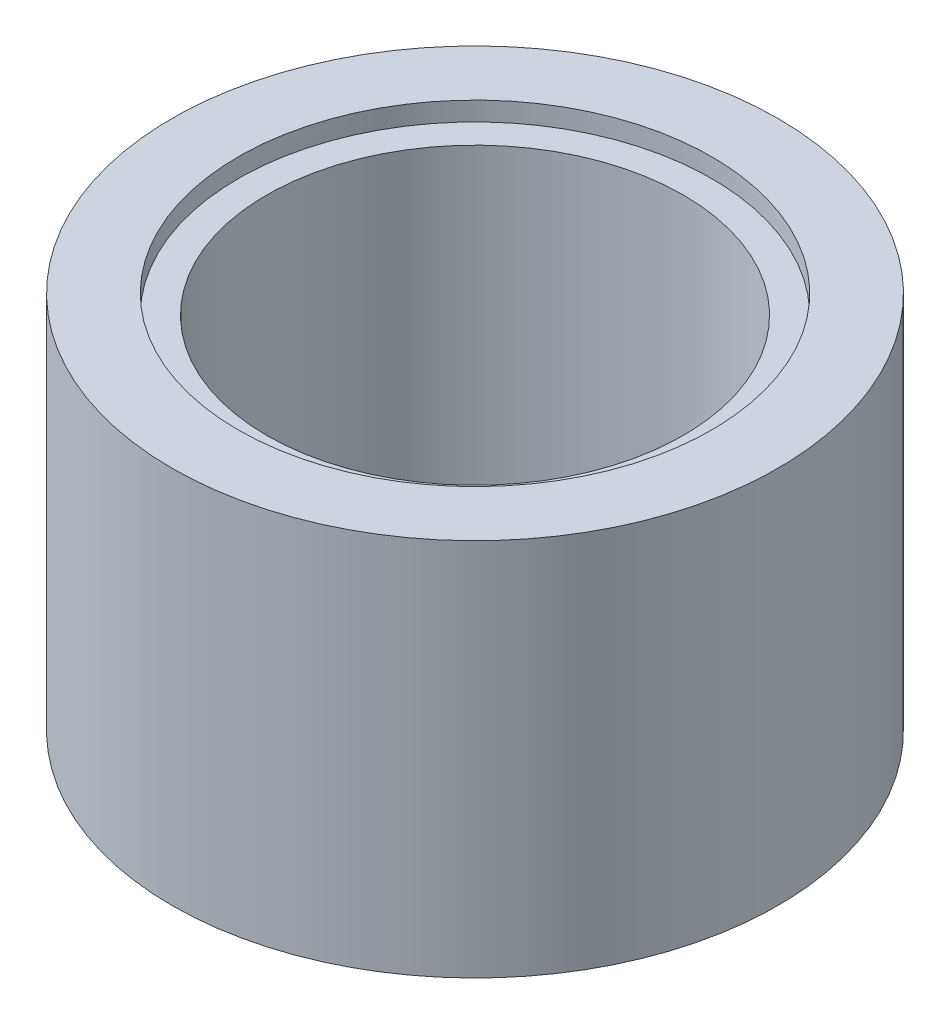
from build123d import *

# Parameters (mm, degrees)
RESSALTO_EXTRUS_O1_DEPTH = 20.2
CORTE_EXTRUS_O1_START    = 20.2
ESBO_O3_R                = 12.5
CORTE_EXTRUS_O1_DEPTH    = 20.2
ESBO_O4_R                = 12.5
CORTE_EXTRUS_O2_DEPTH    = 20.2


with BuildPart() as part:
    # Esboço1 → Revolução1 (revolve)
    with BuildSketch(Plane.XY, mode=Mode.PRIVATE) as revolu_o1_sk:
        Polygon((12.5, 10.813953488), (12.5, 9.813953488), (11, 9.813953488), (11, -8.186046512), (12.5, -8.186046512), (12.5, -9.186046512), (16, -9.186046512), (16, 10.813953488), align=None)
    revolve(revolu_o1_sk.sketch.rotate(Axis((0, 52.869426426, 0), (0, -1, 0)), 90), axis=Axis((0, 52.869426426, 0), (0, -1, 0)))

    # Esboço2 → Ressalto-extrusão1 (add)
    # profile 1 of 8: a face of its own
    with BuildSketch(Plane(origin=(0, 10.813953488, 0), x_dir=(1, 0, 0), z_dir=(0, 1, 0))):
        with BuildLine():
            Line((1.516024046, -15.369686132), (2.077417154, -15.320887515))
            add(Edge.make_bspline(
                [(2.077417154, -15.320887515), (2.113263017, -15.317733839), (2.181909726, -15.311694386), (2.280110643, -15.300785736), (2.368958221, -15.290206131), (2.448127137, -15.278753129), (2.517798588, -15.266435607), (2.57805209, -15.253936485), (2.629210785, -15.241979583), (2.65933787, -15.231646169), (2.672931541, -15.226983619)],
                knots=[0, 0, 0, 0, 1.429554395, 2.737671673, 3.925187674, 4.984139213, 5.915277066, 6.73534434, 7.429373519, 8, 8, 8, 8], degree=3))
            add(Edge.make_bspline(
                [(2.672931541, -15.226983619), (2.692642711, -15.219281418), (2.73125375, -15.204194034), (2.784498092, -15.174763598), (2.833025706, -15.142609039), (2.875804894, -15.106194855), (2.912938981, -15.065642778), (2.945100974, -15.021438877), (2.971399952, -14.97286896), (2.992732084, -14.921107089), (3.007997049, -14.866299625), (3.017531597, -14.809369359), (3.021093795, -14.750433752), (3.018837236, -14.689510248), (3.010437457, -14.626875994), (2.997335518, -14.562043675), (2.977488989, -14.495563764), (2.960240723, -14.451373239), (2.951424105, -14.428784824)],
                knots=[0, 0, 0, 0, 1.054736728, 2.066061024, 3.02803467, 3.955327317, 4.860821345, 5.765487707, 6.675438123, 7.609812719, 8.552964975, 9.507590628, 10.484452325, 11.493601515, 12.544163306, 13.633924628, 14.79055771, 16, 16, 16, 16], degree=3))
            add(Edge.make_bspline(
                [(2.951424105, -14.428784824), (2.934851905, -14.390963262), (2.901900295, -14.315760128), (2.837638355, -14.210506898), (2.763531062, -14.112329753), (2.678974298, -14.022016542), (2.584824013, -13.940825382), (2.4810925, -13.871224583), (2.369222482, -13.812683943), (2.249254069, -13.767159466), (2.123146538, -13.733607458), (1.992334777, -13.711805278), (1.85725557, -13.703677947), (1.766323258, -13.708722233), (1.720244822, -13.711278341)],
                knots=[0, 0, 0, 0, 0.970593667, 1.929896092, 2.893173001, 3.860534365, 4.835136243, 5.811741742, 6.793078132, 7.79939175, 8.824122808, 9.858616152, 10.914889349, 12, 12, 12, 12], degree=3))
            Line((1.720244822, -13.711278341), (2.128189883, -12.314004689))
            Line((2.128189883, -12.314004689), (1.705691892, -12.35101367))
            Line((1.705691892, -12.35101367), (1.300008988, -13.747276245))
            Line((1.300008988, -13.747276245), (1.247793142, -13.752254449))
            Line((1.247793142, -13.752254449), (0.711636256, -12.438011675))
            Line((0.711636256, -12.438011675), (0.333556563, -12.470813528))
            Line((0.333556563, -12.470813528), (1.516024046, -15.369686132))
        make_face()
        with BuildLine():
            Line((1.751625878, -14.987389323), (1.389050261, -14.098303753))
            Line((1.389050261, -14.098303753), (1.761662147, -14.06219833))
            add(Edge.make_bspline(
                [(1.761662147, -14.06219833), (1.801496538, -14.059232991), (1.876293228, -14.053665), (1.981707932, -14.054507306), (2.072774403, -14.062092237), (2.151171884, -14.077781969), (2.220194889, -14.102331565), (2.283359663, -14.135149645), (2.344208392, -14.17430988), (2.399354948, -14.222609067), (2.450638483, -14.27549421), (2.494847106, -14.333788374), (2.533585249, -14.395857781), (2.55326284, -14.440352707), (2.563179874, -14.462777084)],
                knots=[0, 0, 0, 0, 1.477116174, 2.773568202, 3.895349981, 4.853093487, 5.722603131, 6.595547905, 7.481480482, 8.392351399, 9.300777425, 10.202285939, 11.093995156, 12, 12, 12, 12], degree=3))
            add(Edge.make_bspline(
                [(2.563179874, -14.462777084), (2.571316369, -14.484038706), (2.587057264, -14.525171526), (2.598972873, -14.588282809), (2.602849716, -14.64896523), (2.59663423, -14.706561278), (2.581968418, -14.759698548), (2.557987715, -14.806334295), (2.525694026, -14.845798033), (2.491883417, -14.872576531), (2.459437417, -14.890567409), (2.428833095, -14.902231831), (2.393093265, -14.913360621), (2.352095506, -14.923494925), (2.305926433, -14.933007295), (2.254142401, -14.94059607), (2.197001532, -14.947760022), (2.157020729, -14.95149213), (2.136214792, -14.953434312)],
                knots=[0, 0, 0, 0, 1.335783433, 2.584211956, 3.758522392, 4.898865759, 5.973217675, 6.98124721, 7.958332554, 8.948878075, 9.496282004, 10.133685347, 10.869820919, 11.696208238, 12.615001599, 13.639743525, 14.771726804, 16, 16, 16, 16], degree=3))
            Line((2.136214792, -14.953434312), (1.751625878, -14.987389323))
        make_face(mode=Mode.SUBTRACT)
    # profile 2 of 8: a face of its own
    with BuildSketch(Plane(origin=(0, 10.813953488, 0), x_dir=(1, 0, 0), z_dir=(0, 1, 0))):
        with BuildLine():
            add(Edge.make_bspline(
                [(5.168055998, -14.61974926), (5.193489772, -14.612183154), (5.243670141, -14.597255366), (5.3161343, -14.570759177), (5.385143323, -14.541970542), (5.450311213, -14.510734068), (5.511242439, -14.475663659), (5.569130417, -14.439485225), (5.622371479, -14.399078377), (5.672863455, -14.357611654), (5.718659051, -14.312111302), (5.761111154, -14.264430449), (5.799818868, -14.214078392), (5.834352104, -14.160849255), (5.865446763, -14.105253451), (5.893165617, -14.047015306), (5.915419363, -13.985534935), (5.942223358, -13.901301978), (5.96466416, -13.792255901), (5.976456524, -13.658832599), (5.970416326, -13.523673238), (5.950036327, -13.386949218), (5.912112975, -13.248932139), (5.859438823, -13.109193689), (5.790181148, -12.967820734), (5.733585137, -12.876409921), (5.704460999, -12.829370191)],
                knots=[0, 0, 0, 0, 0.852826853, 1.682611723, 2.478706154, 3.255956535, 4.003621665, 4.737742638, 5.448444647, 6.150576596, 6.836456885, 7.521096691, 8.201666468, 8.875839165, 9.558841728, 10.248309801, 10.946384605, 11.658805717, 13.088818744, 14.51450468, 15.953781222, 17.42756226, 18.949185421, 20.54545786, 22.222302952, 24, 24, 24, 24], degree=3))
            add(Edge.make_bspline(
                [(5.704460999, -12.829370191), (5.672986869, -12.783056907), (5.61015858, -12.690606873), (5.503121031, -12.561572766), (5.387076201, -12.440918591), (5.262099841, -12.328492408), (5.127565858, -12.225040156), (4.983451233, -12.130298532), (4.829965612, -12.044179341), (4.669285156, -11.966815014), (4.504763856, -11.901158509), (4.340280256, -11.848938534), (4.177452689, -11.811629179), (4.016551656, -11.789558699), (3.857415483, -11.781013016), (3.700449848, -11.787891457), (3.545071552, -11.808487633), (3.444178877, -11.834394432), (3.393520843, -11.84740219)],
                knots=[0, 0, 0, 0, 1.004883579, 2.005936806, 3.005444722, 4.008311774, 5.021106379, 6.04949647, 7.102054222, 8.178669655, 9.249061565, 10.279706934, 11.274076825, 12.24432949, 13.192186435, 14.131220685, 15.06168921, 16, 16, 16, 16], degree=3))
            add(Edge.make_bspline(
                [(3.393520843, -11.84740219), (3.369658174, -11.854458471), (3.322619579, -11.86836796), (3.254672211, -11.893384433), (3.190013469, -11.920856578), (3.129000794, -11.95122695), (3.0713671, -11.984359474), (3.017339611, -12.020255756), (2.966694605, -12.058964998), (2.91988673, -12.100567951), (2.875700557, -12.143975099), (2.836459992, -12.191245558), (2.799263175, -12.240309766), (2.766740566, -12.292978508), (2.736545027, -12.347738635), (2.711505695, -12.405856019), (2.688647753, -12.466197361), (2.663082183, -12.549950749), (2.640754903, -12.657988765), (2.630095007, -12.790240818), (2.635679547, -12.924078051), (2.655992065, -13.059690441), (2.694123123, -13.196470641), (2.746618826, -13.335103834), (2.815946457, -13.475035844), (2.872005932, -13.565804167), (2.900865113, -13.612531314)],
                knots=[0, 0, 0, 0, 0.819233324, 1.614889931, 2.38271577, 3.131635996, 3.857723118, 4.570412591, 5.266172037, 5.95479659, 6.631662535, 7.303398312, 7.975910962, 8.657421696, 9.33979383, 10.033204054, 10.739053121, 11.463850646, 12.914840829, 14.362107669, 15.821753685, 17.316744485, 18.867242849, 20.488207846, 22.192144293, 24, 24, 24, 24], degree=3))
            add(Edge.make_bspline(
                [(2.900865113, -13.612531314), (2.921790672, -13.64365046), (2.963597543, -13.705822949), (3.031889051, -13.795389903), (3.104954334, -13.881411506), (3.18254883, -13.964355333), (3.264292068, -14.044409207), (3.351183222, -14.12050004), (3.442389109, -14.193475693), (3.537333838, -14.263029653), (3.635363654, -14.328438403), (3.735766517, -14.387904554), (3.837149489, -14.442292481), (3.939676737, -14.491508932), (4.043889509, -14.534619505), (4.149570291, -14.571951708), (4.256426516, -14.604002321), (4.363968124, -14.630630129), (4.471225019, -14.650942508), (4.576954074, -14.665295206), (4.680485144, -14.673535529), (4.782283887, -14.67559474), (4.881864668, -14.671074989), (4.979454382, -14.660838902), (5.074849637, -14.644013624), (5.137026925, -14.627827043), (5.168055998, -14.61974926)],
                knots=[0, 0, 0, 0, 1.023438641, 2.044713191, 3.072408161, 4.102950259, 5.144013593, 6.194098677, 7.254158618, 8.331466217, 9.405772335, 10.469562786, 11.515368312, 12.545344517, 13.572530241, 14.592149385, 15.603421293, 16.61653933, 17.61482269, 18.581657687, 19.527625814, 20.448205477, 21.359055375, 22.24676542, 23.125062452, 24, 24, 24, 24], degree=3))
        make_face()
        with BuildLine():
            add(Edge.make_bspline(
                [(4.974863724, -14.299690104), (4.953841617, -14.305245789), (4.911365845, -14.31647121), (4.845534698, -14.326342959), (4.777429985, -14.333590634), (4.706982138, -14.335096668), (4.634006453, -14.332949666), (4.558993606, -14.325993046), (4.481574676, -14.314509001), (4.374910616, -14.294329427), (4.241000466, -14.256869919), (4.083195593, -14.195612965), (3.92867985, -14.117212904), (3.804443307, -14.038707488), (3.707608832, -13.968596676), (3.63768382, -13.911922998), (3.57028394, -13.852207629), (3.506019279, -13.789306582), (3.445453617, -13.722479917), (3.386927745, -13.653491382), (3.332127668, -13.580540205), (3.298213159, -13.529789404), (3.281169134, -13.504284157)],
                knots=[0, 0, 0, 0, 0.65631654, 1.326106448, 2.008031022, 2.724081162, 3.452425234, 4.212429153, 4.9980401, 5.815802657, 7.490318425, 9.189404881, 10.921358311, 12.71562056, 13.622382436, 14.531322093, 15.433144437, 16.341600594, 17.245956807, 18.15644596, 19.073506234, 20, 20, 20, 20], degree=3))
            add(Edge.make_bspline(
                [(3.281169134, -13.504284157), (3.25792889, -13.467039576), (3.21283444, -13.394771662), (3.157798716, -13.283404666), (3.114009293, -13.174706003), (3.083127175, -13.067937249), (3.065331767, -12.963021974), (3.059916209, -12.860391453), (3.066984305, -12.759767267), (3.087051398, -12.662874955), (3.116967419, -12.571056698), (3.156919961, -12.486776303), (3.205650751, -12.410705075), (3.264673734, -12.344078006), (3.331916631, -12.285081938), (3.409318037, -12.236206694), (3.494831402, -12.194071342), (3.556754161, -12.174777901), (3.588622736, -12.164848523)],
                knots=[0, 0, 0, 0, 1.291537752, 2.506048847, 3.65102329, 4.737154995, 5.770851479, 6.776537519, 7.755419125, 8.731383893, 9.681883457, 10.591333095, 11.469765507, 12.331615824, 13.203114208, 14.093556132, 15.018847862, 16, 16, 16, 16], degree=3))
            add(Edge.make_bspline(
                [(3.588622736, -12.164848523), (3.612451172, -12.15852668), (3.660271245, -12.145839696), (3.733765312, -12.132944567), (3.808772758, -12.124110247), (3.885378731, -12.121324216), (3.963585342, -12.121807845), (4.04314197, -12.128453616), (4.124460953, -12.138492855), (4.234468065, -12.159582206), (4.371500201, -12.195939664), (4.531911196, -12.257103294), (4.687340748, -12.335686284), (4.837055657, -12.429698606), (4.978542929, -12.537452014), (5.107286855, -12.65920423), (5.225649046, -12.791021742), (5.292452064, -12.888308065), (5.326004085, -12.93717042)],
                knots=[0, 0, 0, 0, 0.584350273, 1.172702728, 1.767615094, 2.373892351, 2.989238737, 3.621031507, 4.265745856, 4.931348638, 6.275727177, 7.621942329, 8.994647838, 10.398944934, 11.808878628, 13.20418096, 14.595791281, 16, 16, 16, 16], degree=3))
            add(Edge.make_bspline(
                [(5.326004085, -12.93717042), (5.341572276, -12.961706394), (5.372202493, -13.009980608), (5.411667959, -13.084374407), (5.447374822, -13.157302427), (5.476350613, -13.230046078), (5.500137846, -13.302058453), (5.518719078, -13.373410489), (5.531692181, -13.44435529), (5.53970341, -13.514430935), (5.541745613, -13.58332551), (5.538074385, -13.650180834), (5.529550694, -13.715146476), (5.514962388, -13.777905602), (5.495259614, -13.838878298), (5.47037175, -13.89763965), (5.440273714, -13.954622981), (5.404030071, -14.008655175), (5.363874012, -14.060156676), (5.319162634, -14.107177275), (5.271121145, -14.150118785), (5.219367755, -14.189087265), (5.163346246, -14.223150822), (5.103929743, -14.253177742), (5.040982396, -14.279174146), (4.99714591, -14.292776166), (4.974863724, -14.299690104)],
                knots=[0, 0, 0, 0, 1.25039308, 2.460132442, 3.622857722, 4.744304211, 5.827674117, 6.885835426, 7.915468077, 8.929821273, 9.919236666, 10.878584119, 11.809330153, 12.736153193, 13.648135106, 14.564387669, 15.479950145, 16.417700352, 17.361457786, 18.287999977, 19.206643525, 20.132583609, 21.072551471, 22.025014544, 22.996110411, 24, 24, 24, 24], degree=3))
        make_face(mode=Mode.SUBTRACT)
    # profile 3 of 8: a face of its own
    with BuildSketch(Plane(origin=(0, 10.813953488, 0), x_dir=(1, 0, 0), z_dir=(0, 1, 0))):
        with BuildLine():
            Line((7.017208584, -13.770182218), (7.526197809, -13.519547372))
            add(Edge.make_bspline(
                [(7.526197809, -13.519547372), (7.551279779, -13.50699373), (7.599794091, -13.482712093), (7.667978375, -13.44369034), (7.73035818, -13.405659932), (7.786066176, -13.367035033), (7.835207628, -13.327850905), (7.878373425, -13.289077406), (7.915064487, -13.249986562), (7.944883155, -13.210202493), (7.969789597, -13.170283899), (7.990024676, -13.129741043), (8.005161983, -13.088155438), (8.016849251, -13.046220232), (8.02305995, -13.003321182), (8.02575379, -12.959769982), (8.023846259, -12.915311908), (8.014593644, -12.85507582), (7.992703644, -12.780287097), (7.953819766, -12.692703149), (7.899197077, -12.608594268), (7.85418016, -12.557206968), (7.830980284, -12.530724057)],
                knots=[0, 0, 0, 0, 1.320805525, 2.554742348, 3.698875567, 4.761062446, 5.745070481, 6.657347345, 7.491962475, 8.265636352, 8.995130876, 9.705709587, 10.395243085, 11.076790568, 11.752237162, 12.432608096, 13.129653145, 13.843544012, 15.298439316, 16.784871053, 18.343054185, 20, 20, 20, 20], degree=3))
            add(Edge.make_bspline(
                [(7.830980284, -12.530724057), (7.807247905, -12.50674433), (7.759527808, -12.458526877), (7.677148443, -12.397330415), (7.588792699, -12.341234854), (7.492991838, -12.294816524), (7.39343233, -12.257296763), (7.292035997, -12.231647435), (7.190438715, -12.217721607), (7.122743203, -12.218451221), (7.089172848, -12.218813038)],
                knots=[0, 0, 0, 0, 0.975972848, 1.962446234, 2.964296092, 4.004450508, 5.039900446, 6.041094716, 7.028574507, 8, 8, 8, 8], degree=3))
            add(Edge.make_bspline(
                [(7.089172848, -12.218813038), (7.108519959, -12.197545471), (7.145732057, -12.156639579), (7.189280993, -12.088773373), (7.222947595, -12.020691215), (7.242705733, -11.95036096), (7.251920788, -11.879635693), (7.25081242, -11.808419078), (7.2404608, -11.736843189), (7.219717779, -11.665585285), (7.190231099, -11.594591486), (7.149624676, -11.525705068), (7.101638276, -11.457030762), (7.063470486, -11.414546665), (7.043863952, -11.392722873)],
                knots=[0, 0, 0, 0, 1.11427963, 2.143197653, 3.119299506, 4.052286049, 4.964790823, 5.879447071, 6.808796478, 7.763789916, 8.753489986, 9.784844433, 10.862089643, 12, 12, 12, 12], degree=3))
            add(Edge.make_bspline(
                [(7.043863952, -11.392722873), (7.022353444, -11.370774884), (6.979213326, -11.326757381), (6.907479526, -11.268160886), (6.831477783, -11.214497536), (6.750906798, -11.16638952), (6.664983832, -11.124532165), (6.574211138, -11.088562575), (6.47850922, -11.057979967), (6.378815438, -11.033640451), (6.276860882, -11.016084734), (6.174012657, -11.007638211), (6.071559852, -11.007776843), (5.969292766, -11.016793372), (5.867527207, -11.035532427), (5.766160887, -11.063307946), (5.664771997, -11.099130009), (5.599010892, -11.129496305), (5.565698408, -11.144878905)],
                knots=[0, 0, 0, 0, 0.919324239, 1.843738701, 2.767686267, 3.702717306, 4.649423906, 5.62554651, 6.623094482, 7.654562167, 8.695192465, 9.716658843, 10.739672953, 11.758583965, 12.785579747, 13.832703228, 14.902116382, 16, 16, 16, 16], degree=3))
            Line((5.565698408, -11.144878905), (4.871239612, -11.486707269))
            Line((4.871239612, -11.486707269), (7.017208584, -13.770182218))
        make_face()
        with BuildLine():
            Line((7.108592189, -13.322717196), (6.492015627, -12.667161238))
            Line((6.492015627, -12.667161238), (6.55147094, -12.638239219))
            add(Edge.make_bspline(
                [(6.55147094, -12.638239219), (6.588999306, -12.620299952), (6.659488136, -12.586604961), (6.761407864, -12.546788053), (6.851700888, -12.519328402), (6.932401792, -12.505299473), (7.007127543, -12.503146528), (7.079702713, -12.509413695), (7.152343274, -12.524247702), (7.223917529, -12.547603615), (7.292444566, -12.578631999), (7.356814912, -12.615270435), (7.415190358, -12.65926231), (7.449630453, -12.69305796), (7.466900731, -12.710005075)],
                knots=[0, 0, 0, 0, 1.503798488, 2.8245567, 3.953200637, 4.911426912, 5.776911075, 6.649219928, 7.540277456, 8.452060021, 9.365883497, 10.256322428, 11.125618116, 12, 12, 12, 12], degree=3))
            add(Edge.make_bspline(
                [(7.466900731, -12.710005075), (7.477324477, -12.721566366), (7.497261232, -12.743678822), (7.522991201, -12.77838075), (7.544012996, -12.812498883), (7.558956645, -12.847018687), (7.570320765, -12.88061689), (7.575191981, -12.914529769), (7.57583892, -12.947891411), (7.570849701, -12.981166084), (7.559838987, -13.013856385), (7.542109841, -13.045769325), (7.519013731, -13.077753256), (7.488416597, -13.108073138), (7.452591503, -13.138941952), (7.409481767, -13.167914087), (7.361049828, -13.197788787), (7.325705055, -13.215649652), (7.307301168, -13.224949736)],
                knots=[0, 0, 0, 0, 1.11246387, 2.127730388, 3.085278108, 3.970107278, 4.812652652, 5.612859259, 6.409339473, 7.191261379, 8.006580737, 8.86145493, 9.792605675, 10.817726452, 11.933229217, 13.169805206, 14.526328516, 16, 16, 16, 16], degree=3))
            Line((7.307301168, -13.224949736), (7.108592189, -13.322717196))
        make_face(mode=Mode.SUBTRACT)
        with BuildLine():
            Line((6.228249487, -12.386141334), (5.479491039, -11.589473633))
            Line((5.479491039, -11.589473633), (5.697457338, -11.482144075))
            add(Edge.make_bspline(
                [(5.697457338, -11.482144075), (5.737122873, -11.463263845), (5.811424109, -11.427897514), (5.919217712, -11.386616624), (6.014742286, -11.359125747), (6.100369581, -11.344883021), (6.180065782, -11.344622473), (6.257830836, -11.352706232), (6.336466399, -11.369490361), (6.414360357, -11.395012478), (6.489218529, -11.428221934), (6.558427061, -11.468238999), (6.621243306, -11.514067611), (6.657466219, -11.55011119), (6.675348616, -11.567905055)],
                knots=[0, 0, 0, 0, 1.488627731, 2.788488305, 3.907525468, 4.853486424, 5.719980331, 6.600330575, 7.499490412, 8.440001353, 9.373895737, 10.269999513, 11.145939577, 12, 12, 12, 12], degree=3))
            add(Edge.make_bspline(
                [(6.675348616, -11.567905055), (6.695245328, -11.590618434), (6.733332941, -11.634097899), (6.774222852, -11.70736473), (6.800398162, -11.7816527), (6.808851821, -11.857201339), (6.80034341, -11.931828723), (6.773735041, -12.002838314), (6.731491511, -12.070494909), (6.692654429, -12.108729923), (6.672353419, -12.128716219)],
                knots=[0, 0, 0, 0, 1.136351899, 2.175280601, 3.14362519, 4.089807519, 5.017799075, 5.950088332, 6.928465416, 8, 8, 8, 8], degree=3))
            add(Edge.make_bspline(
                [(6.672353419, -12.128716219), (6.66360538, -12.136210608), (6.644698451, -12.152408056), (6.612030321, -12.176273696), (6.572787334, -12.201621897), (6.527998194, -12.22997251), (6.475964866, -12.258733688), (6.41843091, -12.290676162), (6.354156559, -12.323847665), (6.309078841, -12.34628033), (6.285659541, -12.357934809)],
                knots=[0, 0, 0, 0, 0.613382877, 1.325689912, 2.152493632, 3.101603523, 4.148143984, 5.318150981, 6.606694625, 8, 8, 8, 8], degree=3))
            Line((6.285659541, -12.357934809), (6.228249487, -12.386141334))
        make_face(mode=Mode.SUBTRACT)
    # profile 4 of 8: a face of its own
    with BuildSketch(Plane(origin=(0, 10.813953488, 0), x_dir=(1, 0, 0), z_dir=(0, 1, 0))):
        with BuildLine():
            add(Edge.make_bspline(
                [(10.032267324, -11.827002597), (10.07383774, -11.794210161), (10.154219912, -11.730801433), (10.258248803, -11.623708079), (10.345886679, -11.513481768), (10.41387989, -11.397236807), (10.465084877, -11.277133499), (10.496178611, -11.151704225), (10.510610902, -11.022186249), (10.504864381, -10.889487913), (10.483222114, -10.757085282), (10.446431531, -10.627239579), (10.393607893, -10.501889172), (10.32507992, -10.381140673), (10.241270173, -10.264641542), (10.142519236, -10.152415363), (10.028147503, -10.044568988), (9.94339116, -9.978876199), (9.899794832, -9.945085638)],
                knots=[0, 0, 0, 0, 1.126171881, 2.177609764, 3.170749134, 4.117233698, 5.036132455, 5.940787259, 6.858616469, 7.801355729, 8.759064294, 9.709336825, 10.667814288, 11.647974982, 12.659083791, 13.717925803, 14.826163878, 16, 16, 16, 16], degree=3))
            add(Edge.make_bspline(
                [(9.899794832, -9.945085638), (9.854163595, -9.912687786), (9.76322975, -9.848125409), (9.618204374, -9.764976046), (9.467891422, -9.692569002), (9.311520756, -9.632149521), (9.149906208, -9.582280576), (8.982366023, -9.544189401), (8.809099562, -9.517821733), (8.632203966, -9.501807298), (8.455610519, -9.498612341), (8.28370922, -9.50816518), (8.118291851, -9.531418931), (7.959934509, -9.568336633), (7.808181967, -9.618367105), (7.663110765, -9.681336449), (7.524627632, -9.757808307), (7.438708246, -9.818860633), (7.395653469, -9.84945436)],
                knots=[0, 0, 0, 0, 1.004478817, 2.001723515, 2.997637233, 3.998146668, 5.009155294, 6.032415932, 7.080528834, 8.154305045, 9.219775689, 10.2494219, 11.242915822, 12.215658323, 13.165549955, 14.108385706, 15.052099471, 16, 16, 16, 16], degree=3))
            add(Edge.make_bspline(
                [(7.395653469, -9.84945436), (7.357322048, -9.880130749), (7.28300112, -9.939609309), (7.18601734, -10.039592505), (7.106139137, -10.145123821), (7.042909392, -10.255976839), (6.997153239, -10.372567699), (6.969217101, -10.494444126), (6.958166211, -10.621414148), (6.963848198, -10.751728771), (6.985367223, -10.882641084), (7.02262164, -11.010884794), (7.075225355, -11.135146273), (7.143225198, -11.255032904), (7.226379623, -11.370654355), (7.324988778, -11.481626139), (7.438137808, -11.589311466), (7.522774035, -11.654464438), (7.566280326, -11.687955584)],
                knots=[0, 0, 0, 0, 1.07302527, 2.080492518, 3.037407049, 3.960897834, 4.862936547, 5.766792999, 6.686221351, 7.642232706, 8.612346681, 9.581153759, 10.556241597, 11.556979193, 12.589552294, 13.665213149, 14.799829329, 16, 16, 16, 16], degree=3))
            add(Edge.make_bspline(
                [(7.566280326, -11.687955584), (7.59673898, -11.709850533), (7.657679741, -11.753657292), (7.753143049, -11.81331226), (7.851307374, -11.868687805), (7.95260885, -11.919194031), (8.057079636, -11.964609363), (8.164088642, -12.006563365), (8.274633317, -12.042441049), (8.387460139, -12.073841208), (8.501650146, -12.099677552), (8.615574053, -12.120913076), (8.72894434, -12.13604403), (8.841692539, -12.145326881), (8.95381715, -12.148923898), (9.065347768, -12.146714558), (9.176120736, -12.138209077), (9.285741285, -12.125439313), (9.392906873, -12.106025821), (9.496793594, -12.082777631), (9.596258344, -12.052618721), (9.692054094, -12.018848155), (9.783211572, -11.978182325), (9.87062819, -11.933672858), (9.953888157, -11.883455322), (10.006137393, -11.845822723), (10.032267324, -11.827002597)],
                knots=[0, 0, 0, 0, 1.026610691, 2.054011904, 3.079494314, 4.110941091, 5.150923404, 6.196959887, 7.255980818, 8.330812481, 9.401804596, 10.459788656, 11.502067041, 12.531237407, 13.555311388, 14.571678087, 15.583166328, 16.595531159, 17.591199409, 18.563211736, 19.507815817, 20.43468169, 21.341790735, 22.237894006, 23.118767827, 24, 24, 24, 24], degree=3))
        make_face()
        with BuildLine():
            add(Edge.make_bspline(
                [(9.735382958, -11.591967006), (9.718611111, -11.604024346), (9.684805065, -11.628327632), (9.62995544, -11.660475761), (9.570831276, -11.688647233), (9.508624036, -11.715404179), (9.441977636, -11.737383499), (9.371910236, -11.757319286), (9.297640741, -11.774145818), (9.219816131, -11.786752034), (9.139764345, -11.797210249), (9.05816187, -11.802037786), (8.975620573, -11.803671586), (8.892012056, -11.79996468), (8.807360203, -11.792452875), (8.721797203, -11.780846755), (8.635260965, -11.765507916), (8.519164088, -11.738390415), (8.375247813, -11.695603318), (8.209058427, -11.625739262), (8.048743831, -11.540965423), (7.949586826, -11.471364965), (7.899610322, -11.436285369)],
                knots=[0, 0, 0, 0, 0.633237258, 1.276379844, 1.946253529, 2.640881643, 3.351516124, 4.096478783, 4.874571314, 5.685161565, 6.513596955, 7.349176605, 8.190629836, 9.044394358, 9.914274024, 10.796110989, 11.691643708, 12.608314387, 14.451469331, 16.28794729, 18.129074009, 20, 20, 20, 20], degree=3))
            add(Edge.make_bspline(
                [(7.899610322, -11.436285369), (7.864747445, -11.409395564), (7.797168048, -11.357271446), (7.706154576, -11.272542274), (7.627007382, -11.185940645), (7.560404265, -11.096681223), (7.506099508, -11.005077484), (7.464083806, -10.91116399), (7.435418017, -10.814595801), (7.418562136, -10.717118129), (7.414145547, -10.620928682), (7.41936462, -10.528354872), (7.437119437, -10.440615341), (7.465906694, -10.358014361), (7.505766706, -10.280252732), (7.558171082, -10.208549009), (7.620032829, -10.140214192), (7.669002836, -10.101198296), (7.694113814, -10.081191615)],
                knots=[0, 0, 0, 0, 1.306442865, 2.532453609, 3.686001433, 4.784978665, 5.832421092, 6.841272503, 7.830996614, 8.815077142, 9.770402798, 10.683735549, 11.56080472, 12.418446508, 13.273300552, 14.144138391, 15.048346049, 16, 16, 16, 16], degree=3))
            add(Edge.make_bspline(
                [(7.694113814, -10.081191615), (7.713537773, -10.066919895), (7.752618682, -10.038205264), (7.815618477, -10.001156646), (7.881049625, -9.967314873), (7.949581961, -9.937193544), (8.021484338, -9.911472306), (8.09619002, -9.888122499), (8.174447285, -9.870301175), (8.25498938, -9.8555734), (8.337516919, -9.844737248), (8.42097679, -9.839303536), (8.50495553, -9.836537562), (8.589375773, -9.840357619), (8.674505786, -9.845985436), (8.760106837, -9.858113493), (8.846447642, -9.873311246), (8.961624023, -9.900047256), (9.103115302, -9.943177103), (9.266415601, -10.011320483), (9.423130432, -10.09357603), (9.519699229, -10.161366193), (9.568119014, -10.195356315)],
                knots=[0, 0, 0, 0, 0.7222174, 1.453097797, 2.188087405, 2.930134405, 3.695346023, 4.476604297, 5.275191223, 6.099755398, 6.930941984, 7.768849311, 8.606498318, 9.448420907, 10.301198125, 11.16329306, 12.038777137, 12.928928875, 14.70689076, 16.465771888, 18.227931075, 20, 20, 20, 20], degree=3))
            add(Edge.make_bspline(
                [(9.568119014, -10.195356315), (9.591336064, -10.212960185), (9.636913695, -10.247518524), (9.700263177, -10.303248353), (9.759422661, -10.359053194), (9.812150768, -10.417370533), (9.860638513, -10.476039281), (9.90315584, -10.536630692), (9.940828312, -10.598208776), (9.972832113, -10.661084875), (9.998476402, -10.725007842), (10.020176585, -10.788573318), (10.034718338, -10.852505478), (10.044240256, -10.916215822), (10.047785497, -10.980052385), (10.045638953, -11.043912231), (10.037879557, -11.107589558), (10.024916603, -11.170820009), (10.005449122, -11.232343692), (9.982424448, -11.292332712), (9.953207964, -11.34916146), (9.919393193, -11.403435321), (9.880832269, -11.454969159), (9.83694309, -11.503381509), (9.788809188, -11.549759452), (9.753356583, -11.577767563), (9.735382958, -11.591967006)],
                knots=[0, 0, 0, 0, 1.259023676, 2.471602363, 3.645185582, 4.772362068, 5.867657119, 6.933285485, 7.968940387, 8.986003086, 9.978628389, 10.944143556, 11.88611322, 12.808415716, 13.725827488, 14.645687873, 15.56672942, 16.49583568, 17.431175328, 18.35311192, 19.270155836, 20.188384538, 21.114702442, 22.048035869, 23.01040077, 24, 24, 24, 24], degree=3))
        make_face(mode=Mode.SUBTRACT)
    # profile 5 of 8: a face of its own
    with BuildSketch(Plane(origin=(0, 10.813953488, 0), x_dir=(1, 0, 0), z_dir=(0, 1, 0))):
        with BuildLine():
            Line((12.682760318, -8.012561249), (12.273234866, -8.155239209))
            add(Edge.make_bspline(
                [(12.273234866, -8.155239209), (12.282060275, -8.177526969), (12.299326296, -8.221130718), (12.320561748, -8.286869956), (12.337394899, -8.351046887), (12.34980361, -8.413922001), (12.357587485, -8.475488878), (12.361351543, -8.535793819), (12.359118592, -8.594743563), (12.354023243, -8.652517496), (12.343013567, -8.709202179), (12.328039763, -8.765224498), (12.308726971, -8.820855264), (12.284426759, -8.875626285), (12.255360877, -8.929853572), (12.222013651, -8.983527987), (12.183882535, -9.036545469), (12.155745932, -9.070491486), (12.141442599, -9.087748052)],
                knots=[0, 0, 0, 0, 1.150245179, 2.250338427, 3.313167161, 4.332990101, 5.323665265, 6.289873205, 7.228913228, 8.152320101, 9.070658096, 9.99606477, 10.933725733, 11.893791646, 12.868666155, 13.88435684, 14.924506003, 16, 16, 16, 16], degree=3))
            add(Edge.make_bspline(
                [(12.141442599, -9.087748052), (12.126297005, -9.104816501), (12.095838483, -9.139141976), (12.044890905, -9.186382627), (11.99057392, -9.231836547), (11.93129657, -9.27351116), (11.868571552, -9.313322777), (11.801866444, -9.350794494), (11.730605228, -9.384619199), (11.630629087, -9.427398267), (11.499096712, -9.471861556), (11.334355693, -9.509373973), (11.162757304, -9.529424679), (11.016319952, -9.533990974), (10.897282951, -9.529235646), (10.807815709, -9.521726398), (10.719139997, -9.50814799), (10.630789688, -9.492240453), (10.543326326, -9.470171847), (10.456273702, -9.444431762), (10.370050617, -9.413412222), (10.313308093, -9.389987334), (10.284822015, -9.378227491)],
                knots=[0, 0, 0, 0, 0.68472289, 1.377010846, 2.083546554, 2.80974882, 3.550498765, 4.3135458, 5.105049194, 5.917524691, 7.577632813, 9.265485146, 10.980590779, 12.756750019, 13.65787911, 14.556415481, 15.450492587, 16.350235804, 17.250521573, 18.157073235, 19.074807525, 20, 20, 20, 20], degree=3))
            add(Edge.make_bspline(
                [(10.284822015, -9.378227491), (10.243734245, -9.359539398), (10.164240268, -9.323382878), (10.054127014, -9.259779295), (9.955878257, -9.191808183), (9.869493978, -9.118920794), (9.796065519, -9.040450756), (9.733937547, -8.957682721), (9.685440863, -8.869135136), (9.648953023, -8.776926693), (9.625333709, -8.683124501), (9.613029354, -8.589641832), (9.615507863, -8.497193899), (9.629983279, -8.40613669), (9.656916061, -8.316219726), (9.698517835, -8.228721369), (9.751182814, -8.141682148), (9.7951854, -8.087923091), (9.817831909, -8.060255286)],
                knots=[0, 0, 0, 0, 1.294586841, 2.504683429, 3.642999537, 4.719097429, 5.741037759, 6.720603123, 7.680681516, 8.628969586, 9.558412646, 10.449823054, 11.325886213, 12.202043653, 13.088995123, 14.008861934, 14.97523464, 16, 16, 16, 16], degree=3))
            add(Edge.make_bspline(
                [(9.817831909, -8.060255286), (9.847739554, -8.027485287), (9.908138656, -7.961305602), (10.014171332, -7.875415337), (10.13090433, -7.797787622), (10.259832937, -7.729540864), (10.400684711, -7.670642953), (10.553324328, -7.620712637), (10.718013701, -7.580258137), (10.832528414, -7.561526444), (10.891469981, -7.551885103)],
                knots=[0, 0, 0, 0, 0.876372361, 1.769851952, 2.689893413, 3.645869299, 4.649987442, 5.705774679, 6.819145296, 8, 8, 8, 8], degree=3))
            Line((10.891469981, -7.551885103), (10.881727873, -7.229795391))
            add(Edge.make_bspline(
                [(10.881727873, -7.229795391), (10.84658547, -7.233192879), (10.776743054, -7.239945085), (10.673150514, -7.255004145), (10.571271832, -7.274573027), (10.47138672, -7.298865354), (10.37288095, -7.327067769), (10.276235507, -7.359651868), (10.181408961, -7.397426157), (10.08824403, -7.438473365), (9.997645447, -7.484121751), (9.910526106, -7.534604833), (9.826207296, -7.588434457), (9.745510438, -7.646783996), (9.667833934, -7.70893025), (9.593907654, -7.775332339), (9.522831037, -7.845464134), (9.4786691, -7.895355898), (9.456476306, -7.920428114)],
                knots=[0, 0, 0, 0, 1.042806163, 2.072484969, 3.09088022, 4.106124642, 5.107967972, 6.116777097, 7.117378931, 8.122136353, 9.123280439, 10.112302432, 11.095234035, 12.077025056, 13.052447249, 14.032310529, 15.011172743, 16, 16, 16, 16], degree=3))
            add(Edge.make_bspline(
                [(9.456476306, -7.920428114), (9.437427684, -7.942986054), (9.400093483, -7.987198314), (9.350613682, -8.056447189), (9.304520969, -8.124029767), (9.265453459, -8.192781616), (9.231153697, -8.260917183), (9.202504972, -8.329172573), (9.179648327, -8.397404201), (9.162263027, -8.46554944), (9.151091031, -8.533757004), (9.144311057, -8.601562297), (9.144179391, -8.669631171), (9.149334879, -8.737568372), (9.159997927, -8.805466852), (9.176182635, -8.873072618), (9.197635699, -8.940716), (9.216040535, -8.98481202), (9.225384261, -9.007198588)],
                knots=[0, 0, 0, 0, 1.200790885, 2.35348079, 3.461023258, 4.527744195, 5.568106703, 6.563432911, 7.53679064, 8.493592699, 9.421490174, 10.346662961, 11.263214538, 12.187165785, 13.116351113, 14.056553288, 15.013355346, 16, 16, 16, 16], degree=3))
            add(Edge.make_bspline(
                [(9.225384261, -9.007198588), (9.24343376, -9.043825749), (9.279843215, -9.117710071), (9.349718965, -9.221157401), (9.432140861, -9.318772959), (9.527081545, -9.410198267), (9.634571427, -9.496193166), (9.754183657, -9.576262203), (9.886595509, -9.65049196), (9.980803721, -9.693560396), (10.029329634, -9.715744611)],
                knots=[0, 0, 0, 0, 0.892969395, 1.801298125, 2.723991331, 3.685140488, 4.68149133, 5.733337936, 6.832460103, 8, 8, 8, 8], degree=3))
            add(Edge.make_bspline(
                [(10.029329634, -9.715744611), (10.082165334, -9.737474053), (10.187392684, -9.780750316), (10.350326719, -9.830069828), (10.515248397, -9.868101401), (10.682769615, -9.892001491), (10.852327869, -9.904790521), (11.024492833, -9.903991756), (11.198918961, -9.889463459), (11.374001548, -9.864226237), (11.545537421, -9.82638935), (11.710052632, -9.777851016), (11.865479168, -9.717627358), (12.011512398, -9.64596921), (12.148631236, -9.563607158), (12.275847242, -9.469433767), (12.395179338, -9.36549113), (12.465739775, -9.28717945), (12.501120298, -9.247912286)],
                knots=[0, 0, 0, 0, 1.021853506, 2.035119007, 3.042310196, 4.048071314, 5.060251842, 6.082865934, 7.125461129, 8.190217416, 9.246138304, 10.266204406, 11.256954858, 12.225290521, 13.17392339, 14.115110019, 15.054875534, 16, 16, 16, 16], degree=3))
            add(Edge.make_bspline(
                [(12.501120298, -9.247912286), (12.522487702, -9.222137408), (12.564381333, -9.17160234), (12.620981489, -9.093083678), (12.670719412, -9.014582342), (12.712798003, -8.935351824), (12.748831349, -8.856600419), (12.77662951, -8.776727931), (12.797459305, -8.696908009), (12.812103473, -8.617247837), (12.819023, -8.538102256), (12.819626706, -8.459703918), (12.813835029, -8.382241708), (12.800168882, -8.306062515), (12.781593826, -8.230721767), (12.754588347, -8.156858358), (12.723172074, -8.08309108), (12.696317598, -8.036222498), (12.682760318, -8.012561249)],
                knots=[0, 0, 0, 0, 1.196792801, 2.346471103, 3.458219985, 4.516833138, 5.551849719, 6.551645883, 7.536345236, 8.499021456, 9.444029925, 10.373079304, 11.29980661, 12.216711394, 13.137524334, 14.070293508, 15.025802243, 16, 16, 16, 16], degree=3))
        make_face()
    # profile 6 of 8: a face of its own
    with BuildSketch(Plane(origin=(0, 10.813953488, 0), x_dir=(1, 0, 0), z_dir=(0, 1, 0))):
        with BuildLine():
            add(Edge.make_bspline(
                [(14.135429009, -6.463204017), (14.147297639, -6.43974786), (14.170708912, -6.393479799), (14.202087732, -6.323596767), (14.227304974, -6.253767647), (14.250075135, -6.185521498), (14.266582582, -6.117533301), (14.278801442, -6.050399128), (14.287335153, -5.984182911), (14.290576366, -5.918526157), (14.288872012, -5.853876319), (14.283056454, -5.789820615), (14.273250441, -5.726481619), (14.257890857, -5.664003569), (14.238299693, -5.60242077), (14.214119266, -5.541717725), (14.185370986, -5.481691738), (14.141016754, -5.40302245), (14.076244612, -5.309801693), (13.986272665, -5.207152991), (13.883657987, -5.115612059), (13.769046322, -5.03428881), (13.642024753, -4.964045857), (13.502834673, -4.904495434), (13.351270726, -4.855812376), (13.245168432, -4.832299563), (13.190615002, -4.820210242)],
                knots=[0, 0, 0, 0, 0.836961536, 1.650934906, 2.436838752, 3.199842164, 3.940335684, 4.661966761, 5.371747683, 6.064386582, 6.752636333, 7.42911262, 8.111098543, 8.791143226, 9.475362197, 10.167149015, 10.869787596, 11.592770254, 13.040675351, 14.47491853, 15.92897717, 17.408494029, 18.940207909, 20.541258955, 22.221657763, 24, 24, 24, 24], degree=3))
            add(Edge.make_bspline(
                [(13.190615002, -4.820210242), (13.134861069, -4.810570023), (13.023748736, -4.791357975), (12.855092583, -4.777982476), (12.686139498, -4.777031657), (12.516581549, -4.788344743), (12.346842787, -4.813626278), (12.176558837, -4.851110328), (12.005919681, -4.901401055), (11.837113043, -4.964224974), (11.673915251, -5.036933236), (11.520882405, -5.119308808), (11.379817623, -5.20997173), (11.251551253, -5.310060169), (11.135210894, -5.418649342), (11.031235534, -5.535818646), (10.93861776, -5.661210113), (10.888151217, -5.751523939), (10.862868196, -5.796769884)],
                knots=[0, 0, 0, 0, 1.009812531, 2.012461175, 3.016397612, 4.02433352, 5.043383189, 6.077504588, 7.135158718, 8.216921749, 9.29120887, 10.322580402, 11.317049303, 12.281564525, 13.223547912, 14.154363205, 15.075362172, 16, 16, 16, 16], degree=3))
            add(Edge.make_bspline(
                [(10.862868196, -5.796769884), (10.851633841, -5.818744659), (10.829444084, -5.862148568), (10.801326033, -5.92832614), (10.776478662, -5.993609312), (10.756257232, -6.058480779), (10.741256513, -6.122959508), (10.729908201, -6.186679888), (10.723003243, -6.249907462), (10.721273908, -6.312595724), (10.723460289, -6.374675645), (10.729951201, -6.436061898), (10.741255144, -6.497070005), (10.756487515, -6.557624034), (10.776706699, -6.617486579), (10.800478935, -6.676876866), (10.829090116, -6.735571752), (10.873371118, -6.812372482), (10.936762509, -6.904598299), (11.026430586, -7.005320402), (11.128997201, -7.09534492), (11.243240038, -7.175411446), (11.369962729, -7.245122734), (11.509252216, -7.303347483), (11.660623691, -7.352340247), (11.766745237, -7.375806696), (11.821308567, -7.387872177)],
                knots=[0, 0, 0, 0, 0.804160643, 1.58835369, 2.342027862, 3.080272651, 3.801015945, 4.498280628, 5.18878752, 5.871877234, 6.540427769, 7.212158868, 7.881728827, 8.561158016, 9.245463553, 9.939511135, 10.644950788, 11.371555198, 12.827665192, 14.283819098, 15.755001212, 17.26580994, 18.822204649, 20.459278607, 22.179506844, 24, 24, 24, 24], degree=3))
            add(Edge.make_bspline(
                [(11.821308567, -7.387872177), (11.858937022, -7.394820397), (11.934009818, -7.40868284), (12.048044116, -7.421762126), (12.16262294, -7.430262334), (12.278080856, -7.432264432), (12.394025525, -7.42893866), (12.510563685, -7.420331636), (12.627777824, -7.405086778), (12.74524996, -7.385408841), (12.861296142, -7.359551857), (12.975044867, -7.330063992), (13.085335446, -7.29483961), (13.192543768, -7.254828018), (13.296076269, -7.209522007), (13.396840761, -7.160379225), (13.493940117, -7.105554509), (13.587983857, -7.047015222), (13.676914658, -6.984077872), (13.760847009, -6.918618915), (13.838241632, -6.849684286), (13.910226789, -6.778492118), (13.975471969, -6.703789505), (14.03542369, -6.626825172), (14.089039611, -6.546708264), (14.12002303, -6.490935886), (14.135429009, -6.463204017)],
                knots=[0, 0, 0, 0, 1.038730381, 2.072378294, 3.114762358, 4.157486969, 5.206280192, 6.263488566, 7.328948447, 8.414749167, 9.496536933, 10.556191209, 11.604462417, 12.638811365, 13.661943942, 14.671979788, 15.681561498, 16.68837001, 17.678570446, 18.638503683, 19.577008008, 20.491223129, 21.385743745, 22.268142834, 23.138863392, 24, 24, 24, 24], degree=3))
        make_face()
        with BuildLine():
            add(Edge.make_bspline(
                [(13.73787288, -6.372790632), (13.727239606, -6.391901357), (13.705894323, -6.430264311), (13.668134025, -6.485265127), (13.625988299, -6.538838569), (13.579361524, -6.591327103), (13.527733959, -6.641938691), (13.471138479, -6.690549393), (13.410347469, -6.738147755), (13.322334204, -6.798956551), (13.204572094, -6.868663886), (13.053027216, -6.938575462), (12.891543939, -6.993520701), (12.75081376, -7.02762878), (12.634968188, -7.047293977), (12.546884246, -7.05774661), (12.458383191, -7.064396186), (12.369256776, -7.066529188), (12.279875231, -7.063414131), (12.190182998, -7.056869227), (12.100109615, -7.045996817), (12.040297931, -7.03474801), (12.010217379, -7.029090748)],
                knots=[0, 0, 0, 0, 0.66745403, 1.339850266, 2.034253218, 2.74781406, 3.481996168, 4.239897577, 5.024740622, 5.838325158, 7.50488506, 9.196234301, 10.924701575, 12.705113726, 13.611221036, 14.511196971, 15.412481389, 16.320218112, 17.23175915, 18.142129743, 19.065638028, 20, 20, 20, 20], degree=3))
            add(Edge.make_bspline(
                [(12.010217379, -7.029090748), (11.967374896, -7.01987513), (11.884228056, -7.001989857), (11.766196915, -6.963993026), (11.657588583, -6.920658392), (11.55975767, -6.868170676), (11.471639653, -6.809187432), (11.393892979, -6.742619285), (11.326407601, -6.668786966), (11.270513618, -6.588168331), (11.224833472, -6.504191325), (11.192601949, -6.417536838), (11.171217062, -6.330619932), (11.163576626, -6.242214804), (11.168561033, -6.15324841), (11.185907932, -6.06318359), (11.215917843, -5.972470325), (11.244337441, -5.913893642), (11.25891089, -5.88385577)],
                knots=[0, 0, 0, 0, 1.293785036, 2.510922085, 3.658153181, 4.743507718, 5.784142858, 6.784790299, 7.759754245, 8.730398595, 9.676044554, 10.576002178, 11.454218676, 12.312348396, 13.186968905, 14.078246572, 15.014533062, 16, 16, 16, 16], degree=3))
            add(Edge.make_bspline(
                [(11.25891089, -5.88385577), (11.270693208, -5.86220289), (11.29437759, -5.818677068), (11.336468057, -5.757114316), (11.381982173, -5.697014475), (11.43230895, -5.639671303), (11.486570143, -5.583886162), (11.546080815, -5.531242756), (11.609791961, -5.480401815), (11.700269606, -5.415777619), (11.820679189, -5.342963301), (11.975071811, -5.272043786), (12.137260224, -5.214088346), (12.30699957, -5.173257043), (12.480663151, -5.148036142), (12.655388753, -5.139442481), (12.829976507, -5.14850576), (12.944850353, -5.167467191), (13.002531552, -5.176988227)],
                knots=[0, 0, 0, 0, 0.589666827, 1.185326575, 1.782720528, 2.393321727, 3.010178367, 3.644182112, 4.293608153, 4.960343614, 6.304529178, 7.654040162, 9.020454709, 10.420605989, 11.825248833, 13.214910213, 14.601532666, 16, 16, 16, 16], degree=3))
            add(Edge.make_bspline(
                [(13.002531552, -5.176988227), (13.030689427, -5.182891714), (13.085690678, -5.194423093), (13.165578549, -5.216806619), (13.241431012, -5.242284625), (13.313196633, -5.271504697), (13.38104227, -5.303944555), (13.444863096, -5.339439619), (13.50431235, -5.379299682), (13.559979006, -5.421766029), (13.610426697, -5.468156122), (13.656324819, -5.516660137), (13.697290238, -5.567582474), (13.732841735, -5.621294953), (13.762375109, -5.677882768), (13.788267538, -5.736224607), (13.80830759, -5.797642502), (13.822817445, -5.8611598), (13.832348052, -5.925823378), (13.836212024, -5.990734885), (13.833884848, -6.055398989), (13.825911566, -6.119594249), (13.81330057, -6.183794512), (13.793500424, -6.247379613), (13.768597825, -6.310829774), (13.748209907, -6.351944669), (13.73787288, -6.372790632)],
                knots=[0, 0, 0, 0, 1.243660254, 2.429262595, 3.584742561, 4.701796935, 5.777278673, 6.83475238, 7.856138924, 8.869561895, 9.859012857, 10.815893814, 11.754569417, 12.681381662, 13.595807605, 14.511504297, 15.438316542, 16.384157711, 17.325546716, 18.261380812, 19.191747789, 20.119005121, 21.056080934, 22.0165225, 22.994342553, 24, 24, 24, 24], degree=3))
        make_face(mode=Mode.SUBTRACT)
    # profile 7 of 8: a face of its own
    with BuildSketch(Plane(origin=(0, 10.813953488, 0), x_dir=(1, 0, 0), z_dir=(0, 1, 0))):
        with BuildLine():
            Line((14.801750462, -4.509728655), (14.967905855, -3.969446054))
            add(Edge.make_bspline(
                [(14.967905855, -3.969446054), (14.978347285, -3.935011387), (14.998347238, -3.869053782), (15.026102507, -3.774327626), (15.049095412, -3.688044085), (15.068181895, -3.610468929), (15.084034072, -3.541700781), (15.094920995, -3.481387418), (15.102404567, -3.429792779), (15.104496447, -3.398199772), (15.105445612, -3.383864838)],
                knots=[0, 0, 0, 0, 1.432818137, 2.744479873, 3.930288601, 4.988054817, 5.925671626, 6.739637955, 7.428126378, 8, 8, 8, 8], degree=3))
            add(Edge.make_bspline(
                [(15.105445612, -3.383864838), (15.105571249, -3.3624458), (15.105816922, -3.320562682), (15.098589758, -3.259459484), (15.086747459, -3.201798932), (15.068271973, -3.147871982), (15.045104908, -3.096904123), (15.014651657, -3.050093756), (14.979964085, -3.005697184), (14.938710442, -2.966129119), (14.893085903, -2.930159748), (14.843274766, -2.898810545), (14.789386882, -2.871904992), (14.731444862, -2.850378625), (14.669401905, -2.833569181), (14.60356697, -2.821152252), (14.53355347, -2.812920907), (14.48547748, -2.811850176), (14.460797313, -2.811300508)],
                knots=[0, 0, 0, 0, 1.050401881, 2.053972084, 3.013819129, 3.934125487, 4.846413431, 5.754026759, 6.66848449, 7.606014753, 8.551758316, 9.516127042, 10.489476115, 11.502967477, 12.544682091, 13.640841399, 14.78890838, 16, 16, 16, 16], degree=3))
            add(Edge.make_bspline(
                [(14.460797313, -2.811300508), (14.419307587, -2.812251868), (14.336409548, -2.814152722), (14.213305344, -2.832936743), (14.092580483, -2.864301176), (13.974880787, -2.907708817), (13.862247339, -2.963921898), (13.756917077, -3.033490123), (13.659578007, -3.115305362), (13.570479402, -3.208555383), (13.490963197, -3.312322377), (13.422190661, -3.424875041), (13.364289584, -3.545730186), (13.33511449, -3.630672896), (13.320316218, -3.673757772)],
                knots=[0, 0, 0, 0, 0.971529054, 1.941151724, 2.909399017, 3.889854155, 4.874971216, 5.851960406, 6.84029207, 7.847991105, 8.867749713, 9.897129152, 10.933376032, 12, 12, 12, 12], degree=3))
            Line((13.320316218, -3.673757772), (12.171931282, -2.755087603))
            Line((12.171931282, -2.755087603), (12.045893932, -3.16315241))
            Line((12.045893932, -3.16315241), (13.195149395, -4.079502706))
            Line((13.195149395, -4.079502706), (13.180553364, -4.127111996))
            Line((13.180553364, -4.127111996), (11.752984013, -4.11465563))
            Line((11.752984013, -4.11465563), (11.63976705, -4.481917415))
            Line((11.63976705, -4.481917415), (14.801750462, -4.509728655))
        make_face()
        with BuildLine():
            Line((14.521615205, -4.13902073), (13.570067186, -4.13083025))
            Line((13.570067186, -4.13083025), (13.676270345, -3.77479195))
            add(Edge.make_bspline(
                [(13.676270345, -3.77479195), (13.688573975, -3.736501169), (13.711591172, -3.664868127), (13.752485017, -3.567502158), (13.793426738, -3.486167392), (13.837698835, -3.419978244), (13.886321209, -3.366257456), (13.939722675, -3.319918029), (13.999367572, -3.280388419), (14.064050057, -3.246885028), (14.132053663, -3.220835508), (14.201810595, -3.201940537), (14.27262697, -3.190140388), (14.320351729, -3.18916579), (14.344251592, -3.188677725)],
                knots=[0, 0, 0, 0, 1.498119309, 2.80262868, 3.931336751, 4.886895166, 5.760053373, 6.623714169, 7.51506381, 8.420094153, 9.333216232, 10.223095436, 11.110152108, 12, 12, 12, 12], degree=3))
            add(Edge.make_bspline(
                [(14.344251592, -3.188677725), (14.366635053, -3.189559549), (14.409946845, -3.191265868), (14.471856272, -3.204237738), (14.528857045, -3.223553224), (14.579331538, -3.251293976), (14.623011542, -3.285013766), (14.656670384, -3.325412622), (14.681088867, -3.370401988), (14.69280777, -3.412322009), (14.696534019, -3.449410527), (14.696887, -3.482241785), (14.693227427, -3.519506168), (14.687913776, -3.561521625), (14.678092678, -3.607833002), (14.666263453, -3.658820068), (14.652177684, -3.714581394), (14.640320756, -3.752837225), (14.634149581, -3.772748235)],
                knots=[0, 0, 0, 0, 1.317649877, 2.54964038, 3.712057872, 4.851175636, 5.927485288, 6.943961686, 7.925725299, 8.92304271, 9.483728648, 10.118954452, 10.853809675, 11.68774941, 12.612905108, 13.640759692, 14.772086322, 16, 16, 16, 16], degree=3))
            Line((14.634149581, -3.772748235), (14.521615205, -4.13902073))
        make_face(mode=Mode.SUBTRACT)
    # profile 8 of 8: a face of its own
    with BuildSketch(Plane(origin=(0, 10.813953488, 0), x_dir=(1, 0, 0), z_dir=(0, 1, 0))):
        Polygon((15.297333032, -2.278586475), (15.559793172, -0.674300124), (15.175197694, -0.728227502), (14.973730999, -1.957165306), (14.110578901, -2.078135048), (14.310269756, -0.860019024), (13.928143613, -0.914151379), (13.728452758, -2.132267403), (12.623928491, -2.287315797), (12.823619347, -1.069199773), (12.439023869, -1.123127151), (12.178339568, -2.716591721), align=None)
    extrude(amount=-RESSALTO_EXTRUS_O1_DEPTH)

    # Esboço3 → Corte-extrusão1 (cut)
    with BuildSketch(Plane.XZ.offset(8.186046512).offset(CORTE_EXTRUS_O1_START)):
        with Locations(Location((0, 0, 0), (0, 0, 90))):
            Circle(ESBO_O3_R)
    extrude(amount=-CORTE_EXTRUS_O1_DEPTH, mode=Mode.SUBTRACT)

    # Esboço4 → Corte-extrusão2 (cut)
    with BuildSketch(Plane(origin=(0, 9.813953488, 0), x_dir=(1, 0, 0), z_dir=(0, 1, 0))):
        with Locations(Location((0, 0, 0), (0, 0, 270))):
            Circle(ESBO_O4_R)
    extrude(amount=CORTE_EXTRUS_O2_DEPTH, mode=Mode.SUBTRACT)


solid = part.part
